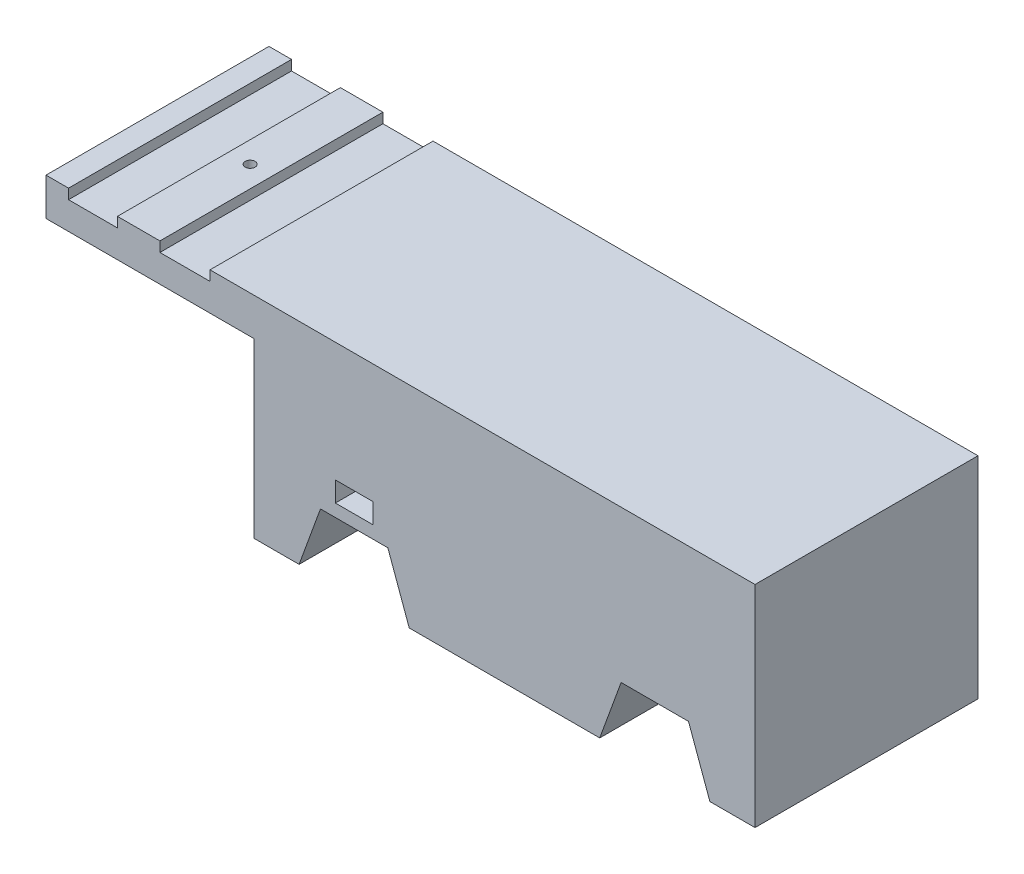
from build123d import *

# Parameters (mm, degrees)
BOSS_EXTRUDE1_DEPTH = 89
SKETCH2_R           = 2
CUT_EXTRUDE1_DEPTH  = 26
BOSS_EXTRUDE2_DEPTH = 89
SKETCH4_W           = 47.922407602
SKETCH4_H           = 26.699627092
BOSS_EXTRUDE3_DEPTH = 20
SKETCH7_R           = 2.5
CUT_EXTRUDE2_DEPTH  = 299.356682512
SKETCH9_W           = 15
SKETCH9_H           = 8
CUT_EXTRUDE3_DEPTH  = 305.5939264
CUT_EXTRUDE4_REACH  = 304.791
SKETCH8_R           = 2.5


with BuildPart() as part:
    # Sketch1 → Boss-Extrude1 (new body)
    with BuildSketch(Plane.XY):
        Polygon((-283, 0), (0, 0), (0, 15), (-217.53, 15), (-217.53, 11), (-237.53, 11), (-237.53, 15), (-254.5, 15), (-254.5, 11), (-274, 11), (-274, 15), (-283, 15), align=None)
    extrude(amount=BOSS_EXTRUDE1_DEPTH)

    # Sketch2 → Cut-Extrude1 (cut)
    with BuildSketch(Plane(origin=(0, 15, 0), x_dir=(1, 0, 0), z_dir=(0, 1, 0))):
        with Locations(Location((-246.015, -44.5, 0), (0, 0, 180))):
            Circle(SKETCH2_R)
    extrude(amount=-CUT_EXTRUDE1_DEPTH, mode=Mode.SUBTRACT)

    # Sketch3 → Boss-Extrude2 (add)
    with BuildSketch(Plane(origin=(0, 0, 0), x_dir=(-1, 0, 0), z_dir=(0, 0, -1))):
        Polygon((0, 0), (0, -61.6), (0, -69.046795722), (18.017528485, -69.046795722), (26.551464217, -45.6), (53.448535783, -45.6), (61.982471515, -69.046795722), (138.017528485, -69.046795722), (146.551464217, -45.6), (173.448535783, -45.6), (181.982471515, -69.046795722), (200, -69.046795722), (200, -61.6), (200, 7.5), (0, 7.5), align=None)
    extrude(amount=-BOSS_EXTRUDE2_DEPTH)

    # Sketch4 → Boss-Extrude3 (add, symmetric)
    with BuildSketch(Plane(origin=(0, 0, 44.5), x_dir=(-1, 0, 0), z_dir=(0, 0, -1))):
        with Locations((40.197751444, -51.696982176)):
            Rectangle(SKETCH4_W, SKETCH4_H)
    extrude(amount=BOSS_EXTRUDE3_DEPTH, both=True)

    # Sketch7 → Cut-Extrude2 (cut, through all)
    with BuildSketch(Plane(origin=(0, 0, 24.5), x_dir=(-1, 0, 0), z_dir=(0, 0, -1))):
        with Locations((40, -61.6)):
            Circle(SKETCH7_R)
    extrude(amount=-CUT_EXTRUDE2_DEPTH, mode=Mode.SUBTRACT)

    # Sketch9 → Cut-Extrude3 (cut, through all)
    with BuildSketch(Plane(origin=(0, 0, 0), x_dir=(-1, 0, 0), z_dir=(0, 0, -1))):
        with Locations((160, -36.6)):
            Rectangle(SKETCH9_W, SKETCH9_H)
    extrude(amount=-CUT_EXTRUDE3_DEPTH, mode=Mode.SUBTRACT)

    # Sketch8 → Cut-Extrude4 (cut, up to next)
    with BuildSketch(Plane.XZ.offset(45.6), mode=Mode.PRIVATE) as cut_extrude4_sk1:
        with Locations(Location((-160, 74, 0), (0, 0, 270))):
            Circle(SKETCH8_R)
    cut_extrude4_tool1 = extrude(cut_extrude4_sk1.sketch, amount=-CUT_EXTRUDE4_REACH, mode=Mode.PRIVATE) & part.part
    # Sketch8 → Cut-Extrude4 (cut, up to next)
    with BuildSketch(Plane.XZ.offset(45.6), mode=Mode.PRIVATE) as cut_extrude4_sk2:
        with Locations(Location((-160, 15, 0), (0, 0, 270))):
            Circle(SKETCH8_R)
    cut_extrude4_tool2 = extrude(cut_extrude4_sk2.sketch, amount=-CUT_EXTRUDE4_REACH, mode=Mode.PRIVATE) & part.part
    add(cut_extrude4_tool1.solids().sort_by_distance((-160, -45.6, 74))[0], mode=Mode.SUBTRACT)
    add(cut_extrude4_tool2.solids().sort_by_distance((-160, -45.6, 15))[0], mode=Mode.SUBTRACT)


solid = part.part
